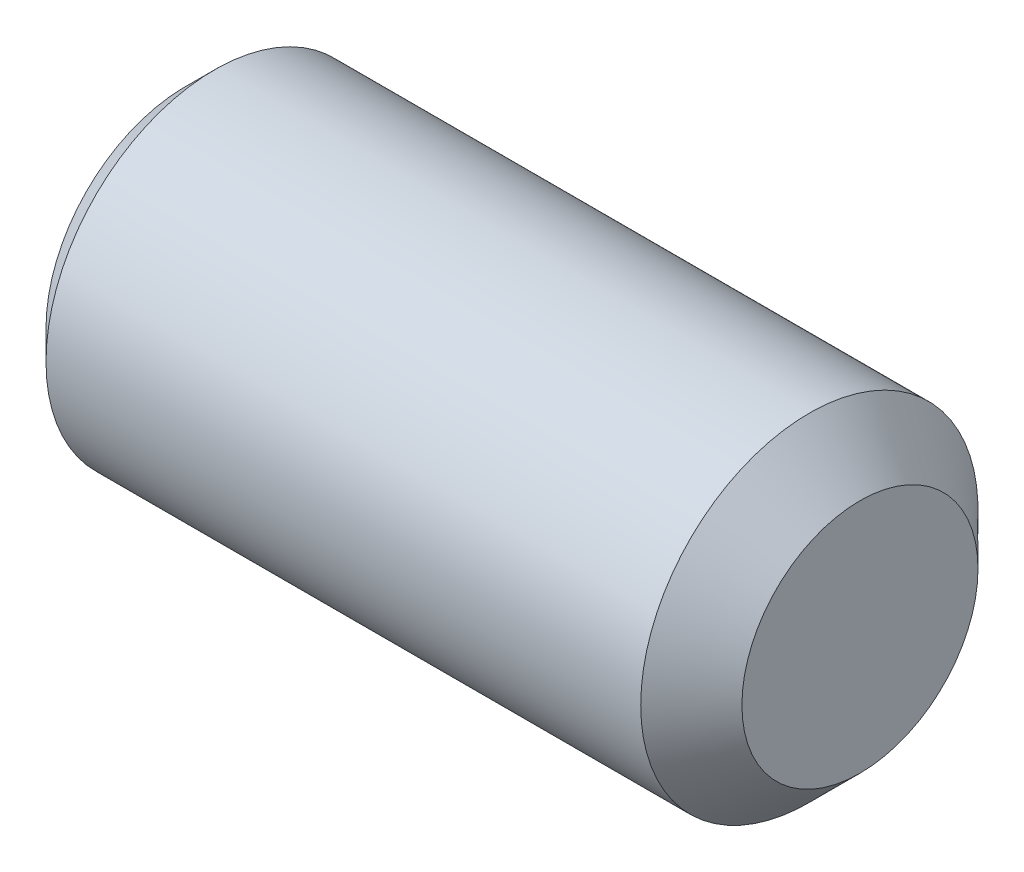
from build123d import *

# Parameters (mm, degrees)
HEXAGONSOCKET_DEPTH = 2


with BuildPart() as part:
    # Sketch1 → Base (revolve)
    with BuildSketch(Plane.XY, mode=Mode.PRIVATE) as base_sk:
        Polygon((0, 0), (10, 0), (10, 1.75), (9.25, 2.5), (0.433, 2.5), (0, 2.067), align=None)
    revolve(base_sk.sketch.rotate(Axis((-10.745014543, 0, 0), (1, 0, 0)), 90), axis=Axis((-10.745014543, 0, 0), (1, 0, 0)))

    # Sketch2 → HexagonSocket (cut)
    with BuildSketch(Plane(origin=(0, -0.021932325, 0.010138848), x_dir=(0, 0, 1), z_dir=(-1, 0, 0))):
        Polygon((1.433236825, 0.021932325), (0.711548988, 1.271932325), (-0.731826685, 1.271932325), (-1.453514521, 0.021932325), (-0.731826685, -1.228067675), (0.711548988, -1.228067675), align=None)
    extrude(amount=-HEXAGONSOCKET_DEPTH, mode=Mode.SUBTRACT)

    # Sketch3 → Cut-Revolve1 (revolve, cut)
    with BuildSketch(Plane.XY, mode=Mode.PRIVATE) as cut_revolve1_sk:
        Polygon((2, 1.25), (2.721687837, 0), (2, 0), align=None)
    revolve(cut_revolve1_sk.sketch.rotate(Axis((-3.144113667, 0, 0), (1, 0, 0)), 90), axis=Axis((-3.144113667, 0, 0), (1, 0, 0)), mode=Mode.SUBTRACT)


solid = part.part
